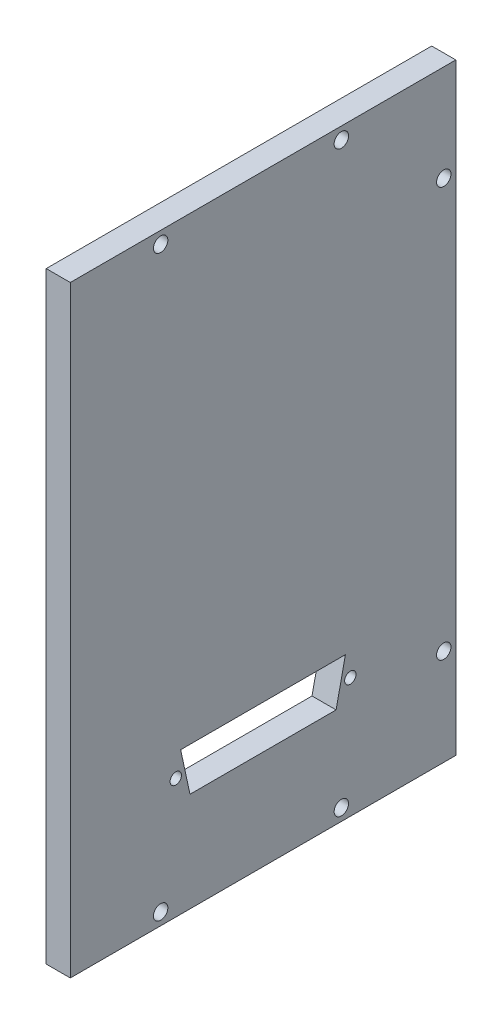
from build123d import *

# Parameters (mm, degrees)
SKETCH1_W             = 101.6
SKETCH1_H             = 158.75
BOSS_EXTRUDE1_DEPTH   = 6.35
SKETCH2_R             = 1.5
CUT_EXTRUDE1_DEPTH    = 95.452914857
CUT_EXTRUDE2_DEPTH    = 95.452914857
F_6_CLEARANCE_HOLE1_D = 3.7973


with BuildPart() as part:
    # Sketch1 → Boss-Extrude1 (new body)
    with BuildSketch(Plane(origin=(0, 0, 0), x_dir=(0, 0, -1), z_dir=(1, 0, 0))):
        Rectangle(SKETCH1_W, SKETCH1_H)
    extrude(amount=BOSS_EXTRUDE1_DEPTH)

    # Sketch2 → Cut-Extrude1 (cut, through all)
    with BuildSketch(Plane(origin=(6.35, 0, 0), x_dir=(0, 0, -1), z_dir=(1, 0, 0))):
        with Locations((23, -47.725)):
            Circle(SKETCH2_R)
        with Locations((-23, -47.725)):
            Circle(SKETCH2_R)
    extrude(amount=-CUT_EXTRUDE1_DEPTH, mode=Mode.SUBTRACT)

    # Sketch3 → Cut-Extrude2 (cut, through all)
    with BuildSketch(Plane(origin=(6.35, 0, 0), x_dir=(0, 0, -1), z_dir=(1, 0, 0))):
        Polygon((-21.709996503, -41.820570024), (-19.255793917, -53.208070024), (19.255793917, -53.208070024), (21.709996503, -41.820570024), align=None)
    extrude(amount=-CUT_EXTRUDE2_DEPTH, mode=Mode.SUBTRACT)

    # #6 Clearance Hole1 (through all)
    with Locations(Plane(origin=(6.35, 0, 0), x_dir=(0, 0, -1), z_dir=(1, 0, 0))):
        with Locations((47.625, -53.975), (-26.9875, 76.2), (20.6375, 76.2), (-26.9875, -76.2), (20.6375, -76.2), (47.625, 53.975)):
            Hole(F_6_CLEARANCE_HOLE1_D / 2)


solid = part.part
